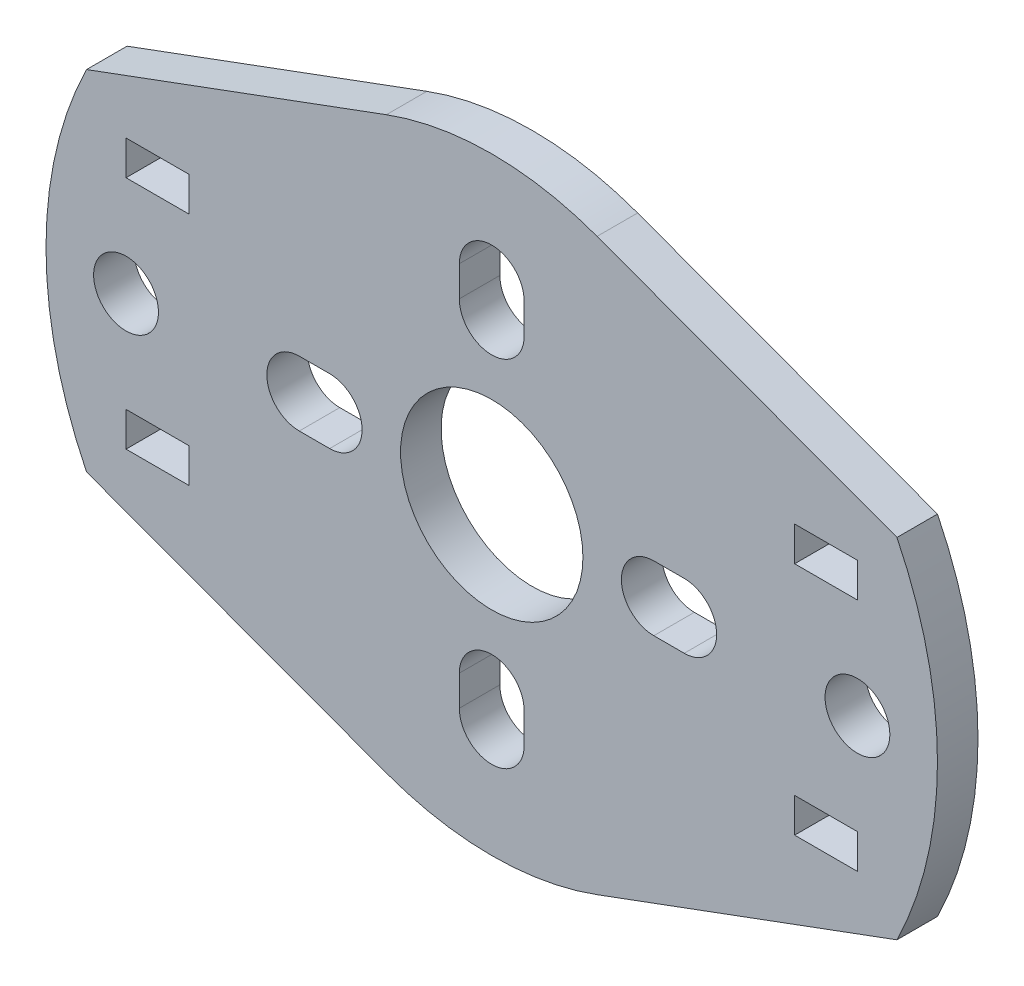
from build123d import *

# Parameters (mm, degrees)
SKETCH1_W           = 3.1
SKETCH1_H           = 1.7
BOSS_EXTRUDE1_DEPTH = 2
CUT_EXTRUDE1_REACH  = 122.95
SKETCH2_R           = 4.5
BOSS_EXTRUDE2_DEPTH = 2
CUT_EXTRUDE2_REACH  = 124.935
SKETCH3_R           = 1.6


with BuildPart() as part:
    # Sketch1 → Boss-Extrude1 (new body)
    with BuildSketch(Plane.XY):
        with BuildLine():
            Line((-105.199970129, 14.069836909), (-120, 8.6))
            Line((-120, 8.6), (-120, -8.6))
            Line((-120, -8.6), (-105.199970129, -14.069836909))
            ThreePointArc((-105.199970129, -14.069836909), (-100, -15), (-94.800029871, -14.069836909))
            Line((-94.800029871, -14.069836909), (-80, -8.6))
            Line((-80, -8.6), (-80, 8.6))
            Line((-80, 8.6), (-94.800029871, 14.069836909))
            ThreePointArc((-94.800029871, 14.069836909), (-100, 15), (-105.199970129, 14.069836909))
        make_face()
        with Locations((-116.5, 5.8)):
            Rectangle(SKETCH1_W, SKETCH1_H, mode=Mode.SUBTRACT)
        with Locations((-83.5, 5.8)):
            Rectangle(SKETCH1_W, SKETCH1_H, mode=Mode.SUBTRACT)
        with Locations((-116.5, -5.8)):
            Rectangle(SKETCH1_W, SKETCH1_H, mode=Mode.SUBTRACT)
        with Locations((-83.5, -5.8)):
            Rectangle(SKETCH1_W, SKETCH1_H, mode=Mode.SUBTRACT)
    extrude(amount=BOSS_EXTRUDE1_DEPTH)

    # Sketch2 → Cut-Extrude1 (cut, up to next)
    with BuildSketch(Plane.XY.offset(2), mode=Mode.PRIVATE) as cut_extrude1_sk1:
        with Locations((-100, 0)):
            Circle(SKETCH2_R)
    cut_extrude1_tool1 = extrude(cut_extrude1_sk1.sketch, amount=-CUT_EXTRUDE1_REACH, mode=Mode.PRIVATE) & part.part
    # Sketch2 → Cut-Extrude1 (cut, up to next)
    with BuildSketch(Plane.XY.offset(2), mode=Mode.PRIVATE) as cut_extrude1_sk2:
        with BuildLine():
            Line((-108, -1.6), (-109.5, -1.6))
            ThreePointArc((-109.5, -1.6), (-111.1, 0), (-109.5, 1.6))
            Line((-109.5, 1.6), (-108, 1.6))
            ThreePointArc((-108, 1.6), (-106.4, 0), (-108, -1.6))
        make_face()
    cut_extrude1_tool2 = extrude(cut_extrude1_sk2.sketch, amount=-CUT_EXTRUDE1_REACH, mode=Mode.PRIVATE) & part.part
    # Sketch2 → Cut-Extrude1 (cut, up to next)
    with BuildSketch(Plane.XY.offset(2), mode=Mode.PRIVATE) as cut_extrude1_sk3:
        with BuildLine():
            Line((-101.6, 8), (-101.6, 9.5))
            ThreePointArc((-101.6, 9.5), (-100, 11.1), (-98.4, 9.5))
            Line((-98.4, 9.5), (-98.4, 8))
            ThreePointArc((-98.4, 8), (-100, 6.4), (-101.6, 8))
        make_face()
    cut_extrude1_tool3 = extrude(cut_extrude1_sk3.sketch, amount=-CUT_EXTRUDE1_REACH, mode=Mode.PRIVATE) & part.part
    # Sketch2 → Cut-Extrude1 (cut, up to next)
    with BuildSketch(Plane.XY.offset(2), mode=Mode.PRIVATE) as cut_extrude1_sk4:
        with BuildLine():
            Line((-92, 1.6), (-90.5, 1.6))
            ThreePointArc((-90.5, 1.6), (-88.9, 0), (-90.5, -1.6))
            Line((-90.5, -1.6), (-92, -1.6))
            ThreePointArc((-92, -1.6), (-93.6, 0), (-92, 1.6))
        make_face()
    cut_extrude1_tool4 = extrude(cut_extrude1_sk4.sketch, amount=-CUT_EXTRUDE1_REACH, mode=Mode.PRIVATE) & part.part
    # Sketch2 → Cut-Extrude1 (cut, up to next)
    with BuildSketch(Plane.XY.offset(2), mode=Mode.PRIVATE) as cut_extrude1_sk5:
        with BuildLine():
            Line((-98.4, -8), (-98.4, -9.5))
            ThreePointArc((-98.4, -9.5), (-100, -11.1), (-101.6, -9.5))
            Line((-101.6, -9.5), (-101.6, -8))
            ThreePointArc((-101.6, -8), (-100, -6.4), (-98.4, -8))
        make_face()
    cut_extrude1_tool5 = extrude(cut_extrude1_sk5.sketch, amount=-CUT_EXTRUDE1_REACH, mode=Mode.PRIVATE) & part.part
    add(cut_extrude1_tool1.solids().sort_by_distance((-100, 0, 2))[0], mode=Mode.SUBTRACT)
    add(cut_extrude1_tool2.solids().sort_by_distance((-108.75, 0, 2))[0], mode=Mode.SUBTRACT)
    add(cut_extrude1_tool3.solids().sort_by_distance((-100, 8.75, 2))[0], mode=Mode.SUBTRACT)
    add(cut_extrude1_tool4.solids().sort_by_distance((-91.25, 0, 2))[0], mode=Mode.SUBTRACT)
    add(cut_extrude1_tool5.solids().sort_by_distance((-100, -8.75, 2))[0], mode=Mode.SUBTRACT)

    # Sketch5 → Boss-Extrude2 (add)
    with BuildSketch(Plane.XY.offset(2)):
        with BuildLine():
            Line((-120, 8.6), (-120, -8.6))
            ThreePointArc((-120, -8.6), (-122, 0), (-120, 8.6))
        make_face()
        with BuildLine():
            Line((-80, 8.6), (-80, -8.6))
            ThreePointArc((-80, -8.6), (-78, 0), (-80, 8.6))
        make_face()
    extrude(amount=-BOSS_EXTRUDE2_DEPTH)

    # Sketch3 → Cut-Extrude2 (cut, up to next)
    with BuildSketch(Plane.XY.offset(2), mode=Mode.PRIVATE) as cut_extrude2_sk1:
        with Locations((-118.05, 0)):
            Circle(SKETCH3_R)
    cut_extrude2_tool1 = extrude(cut_extrude2_sk1.sketch, amount=-CUT_EXTRUDE2_REACH, mode=Mode.PRIVATE) & part.part
    # Sketch3 → Cut-Extrude2 (cut, up to next)
    with BuildSketch(Plane.XY.offset(2), mode=Mode.PRIVATE) as cut_extrude2_sk2:
        with Locations((-81.95, 0)):
            Circle(SKETCH3_R)
    cut_extrude2_tool2 = extrude(cut_extrude2_sk2.sketch, amount=-CUT_EXTRUDE2_REACH, mode=Mode.PRIVATE) & part.part
    add(cut_extrude2_tool1.solids().sort_by_distance((-118.05, 0, 2))[0], mode=Mode.SUBTRACT)
    add(cut_extrude2_tool2.solids().sort_by_distance((-81.95, 0, 2))[0], mode=Mode.SUBTRACT)


solid = part.part
